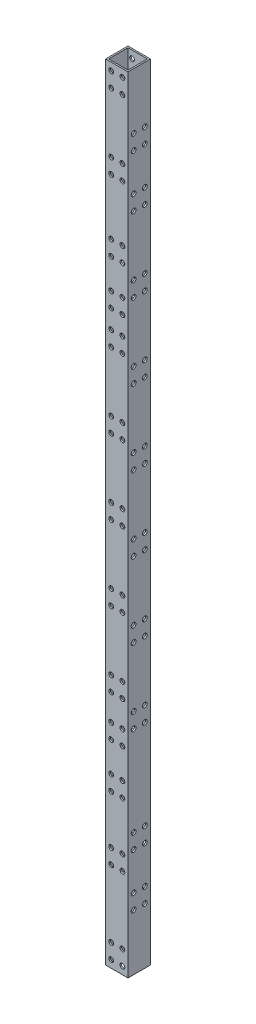
from build123d import *

# Parameters (mm, degrees)
SKETCH_1_W          = 15
SKETCH_1_H          = 15
SKETCH_1_W_2        = 13
SKETCH_1_H_2        = 13
EXTRUDE_1_DEPTH     = 525
SKETCH_2_R          = 1.6
CUT_EXTRUDE_1_DEPTH = 15
SKETCH_3_R          = 1.6
CUT_EXTRUDE_2_DEPTH = 15


with BuildPart() as part:
    # 草图1 → 凸台-拉伸1 (new body)
    with BuildSketch(Plane(origin=(0, 0, 0), x_dir=(1, 0, 0), z_dir=(0, 1, 0))):
        Rectangle(SKETCH_1_W, SKETCH_1_H)
        Rectangle(SKETCH_1_W_2, SKETCH_1_H_2, mode=Mode.SUBTRACT)
    extrude(amount=EXTRUDE_1_DEPTH)

    # 草图2 → 切除-拉伸1 (cut)
    with BuildSketch(Plane.XY.offset(7.5)):
        with Locations((3.75, 520)):
            Circle(SKETCH_2_R)
        with Locations((-3.75, 520)):
            Circle(SKETCH_2_R)
        with Locations((-3.75, 510)):
            Circle(SKETCH_2_R)
        with Locations((3.75, 510)):
            Circle(SKETCH_2_R)
        with Locations((3.75, 15)):
            Circle(SKETCH_2_R)
        with Locations((-3.75, 15)):
            Circle(SKETCH_2_R)
        with Locations((-3.75, 5)):
            Circle(SKETCH_2_R)
        with Locations((3.75, 5)):
            Circle(SKETCH_2_R)
        with Locations((-3.75, 470)):
            Circle(SKETCH_2_R)
        with Locations((3.75, 470)):
            Circle(SKETCH_2_R)
        with Locations((3.75, 460)):
            Circle(SKETCH_2_R)
        with Locations((-3.75, 460)):
            Circle(SKETCH_2_R)
        with Locations((-3.75, 370)):
            Circle(SKETCH_2_R)
        with Locations((3.75, 370)):
            Circle(SKETCH_2_R)
        with Locations((3.75, 360)):
            Circle(SKETCH_2_R)
        with Locations((-3.75, 360)):
            Circle(SKETCH_2_R)
        with Locations((-3.75, 320)):
            Circle(SKETCH_2_R)
        with Locations((3.75, 320)):
            Circle(SKETCH_2_R)
        with Locations((3.75, 310)):
            Circle(SKETCH_2_R)
        with Locations((-3.75, 310)):
            Circle(SKETCH_2_R)
        with Locations((-3.75, 270)):
            Circle(SKETCH_2_R)
        with Locations((3.75, 270)):
            Circle(SKETCH_2_R)
        with Locations((3.75, 260)):
            Circle(SKETCH_2_R)
        with Locations((-3.75, 260)):
            Circle(SKETCH_2_R)
        with Locations((-3.75, 220)):
            Circle(SKETCH_2_R)
        with Locations((3.75, 220)):
            Circle(SKETCH_2_R)
        with Locations((3.75, 210)):
            Circle(SKETCH_2_R)
        with Locations((-3.75, 210)):
            Circle(SKETCH_2_R)
        with Locations((-3.75, 170)):
            Circle(SKETCH_2_R)
        with Locations((3.75, 170)):
            Circle(SKETCH_2_R)
        with Locations((3.75, 160)):
            Circle(SKETCH_2_R)
        with Locations((-3.75, 160)):
            Circle(SKETCH_2_R)
        with Locations((-3.75, 70)):
            Circle(SKETCH_2_R)
        with Locations((3.75, 70)):
            Circle(SKETCH_2_R)
        with Locations((3.75, 60)):
            Circle(SKETCH_2_R)
        with Locations((-3.75, 60)):
            Circle(SKETCH_2_R)
        with Locations((-3.75, 422.5)):
            Circle(SKETCH_2_R)
        with Locations((3.75, 422.5)):
            Circle(SKETCH_2_R)
        with Locations((3.75, 412.5)):
            Circle(SKETCH_2_R)
        with Locations((-3.75, 412.5)):
            Circle(SKETCH_2_R)
        with Locations((-3.75, 392.5)):
            Circle(SKETCH_2_R)
        with Locations((3.75, 392.5)):
            Circle(SKETCH_2_R)
        with Locations((3.75, 382.5)):
            Circle(SKETCH_2_R)
        with Locations((-3.75, 382.5)):
            Circle(SKETCH_2_R)
        with Locations((-3.75, 142.5)):
            Circle(SKETCH_2_R)
        with Locations((3.75, 142.5)):
            Circle(SKETCH_2_R)
        with Locations((3.75, 132.5)):
            Circle(SKETCH_2_R)
        with Locations((-3.75, 132.5)):
            Circle(SKETCH_2_R)
        with Locations((-3.75, 112.5)):
            Circle(SKETCH_2_R)
        with Locations((3.75, 112.5)):
            Circle(SKETCH_2_R)
        with Locations((3.75, 102.5)):
            Circle(SKETCH_2_R)
        with Locations((-3.75, 102.5)):
            Circle(SKETCH_2_R)
    extrude(amount=-CUT_EXTRUDE_1_DEPTH, mode=Mode.SUBTRACT)

    # 草图3 → 切除-拉伸2 (cut)
    with BuildSketch(Plane.ZY.offset(7.5)):
        with Locations((-3.75, 487.5)):
            Circle(SKETCH_3_R)
        with Locations((3.75, 487.5)):
            Circle(SKETCH_3_R)
        with Locations((-3.75, 477.5)):
            Circle(SKETCH_3_R)
        with Locations((3.75, 477.5)):
            Circle(SKETCH_3_R)
        with Locations((3.75, 452.5)):
            Circle(SKETCH_3_R)
        with Locations((-3.75, 452.5)):
            Circle(SKETCH_3_R)
        with Locations((3.75, 442.5)):
            Circle(SKETCH_3_R)
        with Locations((-3.75, 442.5)):
            Circle(SKETCH_3_R)
        with Locations((-3.75, 82.5)):
            Circle(SKETCH_3_R)
        with Locations((3.75, 82.5)):
            Circle(SKETCH_3_R)
        with Locations((-3.75, 72.5)):
            Circle(SKETCH_3_R)
        with Locations((3.75, 72.5)):
            Circle(SKETCH_3_R)
        with Locations((3.75, 47.5)):
            Circle(SKETCH_3_R)
        with Locations((-3.75, 47.5)):
            Circle(SKETCH_3_R)
        with Locations((3.75, 37.5)):
            Circle(SKETCH_3_R)
        with Locations((-3.75, 37.5)):
            Circle(SKETCH_3_R)
        with Locations((-3.75, 402.5)):
            Circle(SKETCH_3_R)
        with Locations((3.75, 402.5)):
            Circle(SKETCH_3_R)
        with Locations((3.75, 392.5)):
            Circle(SKETCH_3_R)
        with Locations((-3.75, 392.5)):
            Circle(SKETCH_3_R)
        with Locations((-3.75, 352.5)):
            Circle(SKETCH_3_R)
        with Locations((3.75, 352.5)):
            Circle(SKETCH_3_R)
        with Locations((3.75, 342.5)):
            Circle(SKETCH_3_R)
        with Locations((-3.75, 342.5)):
            Circle(SKETCH_3_R)
        with Locations((-3.75, 302.5)):
            Circle(SKETCH_3_R)
        with Locations((3.75, 302.5)):
            Circle(SKETCH_3_R)
        with Locations((3.75, 292.5)):
            Circle(SKETCH_3_R)
        with Locations((-3.75, 292.5)):
            Circle(SKETCH_3_R)
        with Locations((-3.75, 252.5)):
            Circle(SKETCH_3_R)
        with Locations((3.75, 252.5)):
            Circle(SKETCH_3_R)
        with Locations((3.75, 242.5)):
            Circle(SKETCH_3_R)
        with Locations((-3.75, 242.5)):
            Circle(SKETCH_3_R)
        with Locations((-3.75, 202.5)):
            Circle(SKETCH_3_R)
        with Locations((3.75, 202.5)):
            Circle(SKETCH_3_R)
        with Locations((3.75, 192.5)):
            Circle(SKETCH_3_R)
        with Locations((-3.75, 192.5)):
            Circle(SKETCH_3_R)
        with Locations((-3.75, 152.5)):
            Circle(SKETCH_3_R)
        with Locations((3.75, 152.5)):
            Circle(SKETCH_3_R)
        with Locations((3.75, 142.5)):
            Circle(SKETCH_3_R)
        with Locations((-3.75, 142.5)):
            Circle(SKETCH_3_R)
    extrude(amount=-CUT_EXTRUDE_2_DEPTH, mode=Mode.SUBTRACT)


solid = part.part
